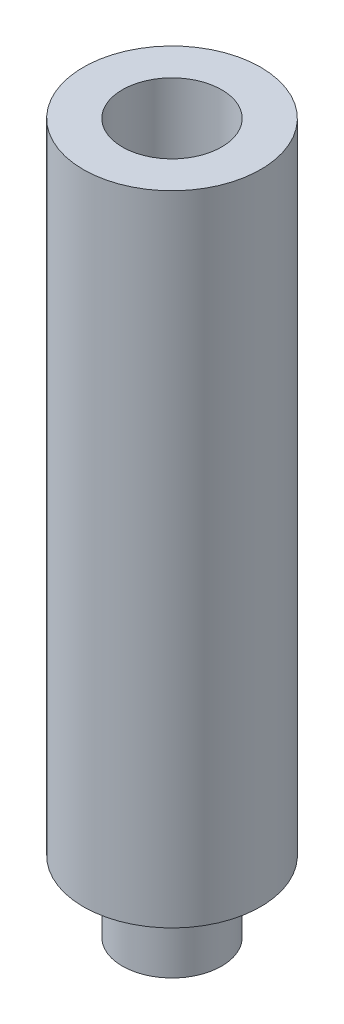
from build123d import *

# Parameters (mm, degrees)
SKETCH_1_R          = 1.4
EXTRUDE_1_DEPTH     = 2
SKETCH_2_R          = 2.5
EXTRUDE_2_DEPTH     = 18
CUT_EXTRUDE_START   = -3
SKETCH_3_R          = 1.4
CUT_EXTRUDE_1_DEPTH = 3


with BuildPart() as part:
    # 草图1 → 凸台-拉伸1 (new body)
    with BuildSketch(Plane(origin=(0, 0, 0), x_dir=(1, 0, 0), z_dir=(0, 1, 0))):
        with Locations(Location((0, 0, 0), (0, 0, 270))):
            Circle(SKETCH_1_R)
    extrude(amount=EXTRUDE_1_DEPTH)

    # 草图2 → 凸台-拉伸2 (add)
    with BuildSketch(Plane(origin=(0, 2, 0), x_dir=(1, 0, 0), z_dir=(0, 1, 0))):
        with Locations(Location((0, 0, 0), (0, 0, 270))):
            Circle(SKETCH_2_R)
    extrude(amount=EXTRUDE_2_DEPTH)

    # 草图3 → 切除-拉伸1 (cut)
    with BuildSketch(Plane(origin=(0, 20, 0), x_dir=(1, 0, 0), z_dir=(0, 1, 0)).offset(CUT_EXTRUDE_START)):
        with Locations(Location((0, 0, 0), (0, 0, 270))):
            Circle(SKETCH_3_R)
    extrude(amount=CUT_EXTRUDE_1_DEPTH, mode=Mode.SUBTRACT)


solid = part.part
